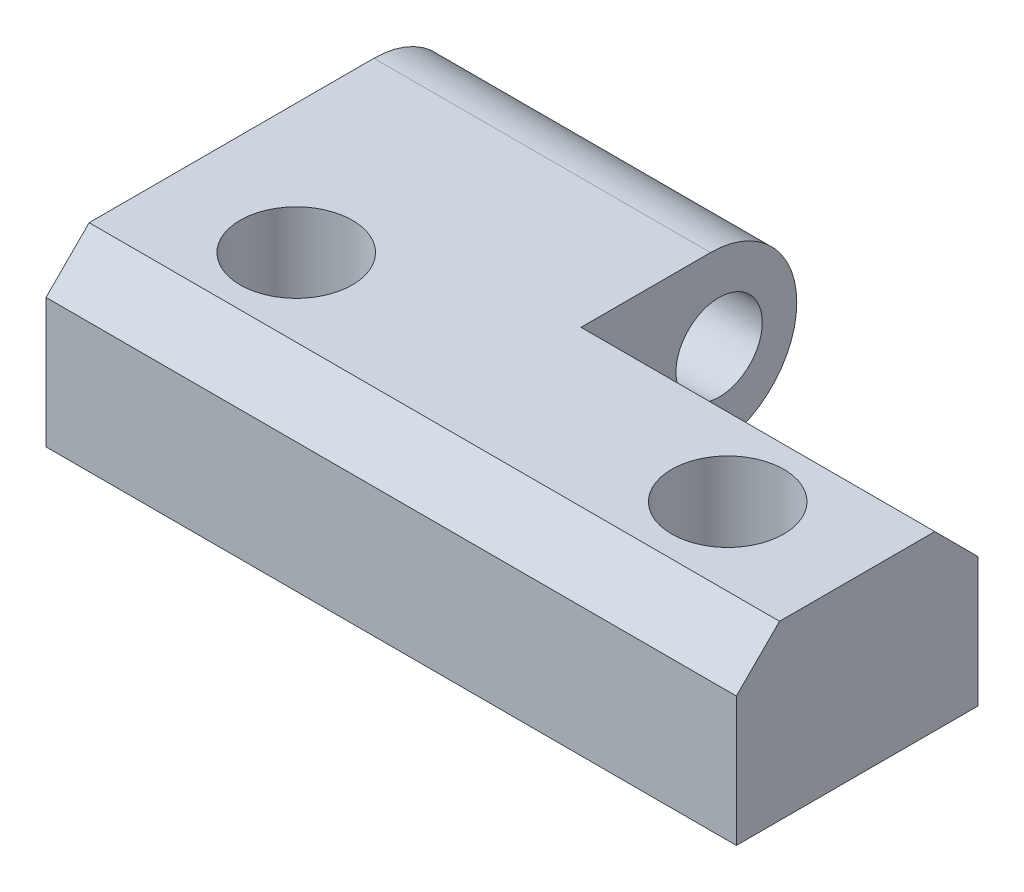
from build123d import *

# Parameters (mm, degrees)
SKIZZE1_R                       = 6.5
AUFSATZ_LINEAR_AUSTRAGEN1_DEPTH = 10
F_10_0MM_STIFTLOCH1_D           = 10
F_10_0MM_STIFTLOCH1_DEPTH       = 22
F_10_0MM_STIFTLOCH1_TIP         = 3.004303095
SCHNITT_LINEAR_AUSTRAGEN2_DEPTH = 49.548944376
FASE1_SIZE                      = 5


with BuildPart() as part:
    # Skizze1 → Aufsatz-Linear austragen1 (new, symmetric)
    with BuildSketch(Plane(origin=(0, 0, 0), x_dir=(1, 0, 0), z_dir=(0, 1, 0))):
        Polygon((-40, -24), (40, -24), (40, 4), (-1, 4), (-1, 24), (-40, 24), align=None)
        with Locations(Location((-25, -10, 0), (0, 0, 270))):
            Circle(SKIZZE1_R, mode=Mode.SUBTRACT)
        with Locations(Location((25, -10, 0), (0, 0, 270))):
            Circle(SKIZZE1_R, mode=Mode.SUBTRACT)
    extrude(amount=AUFSATZ_LINEAR_AUSTRAGEN1_DEPTH, both=True)

    # Ø10.0mm Stiftloch1
    with Locations(Plane(origin=(-1, 0, 0), x_dir=(0, 0, -1), z_dir=(1, 0, 0))):
        with Locations((15, 0)):
            Hole(F_10_0MM_STIFTLOCH1_D / 2, depth=F_10_0MM_STIFTLOCH1_DEPTH)
            with Locations((0, 0, -(F_10_0MM_STIFTLOCH1_DEPTH + F_10_0MM_STIFTLOCH1_TIP / 2))):  # 118° drill point
                Cone(0, F_10_0MM_STIFTLOCH1_D / 2, F_10_0MM_STIFTLOCH1_TIP, mode=Mode.SUBTRACT)

    # Skizze5 → Schnitt-Linear austragen2 (cut, through all)
    with BuildSketch(Plane(origin=(-1, 0, 0), x_dir=(0, 0, -1), z_dir=(1, 0, 0))):
        with BuildLine():
            Line((14, 10), (26, 10))
            Line((26, 10), (26, -10))
            Line((26, -10), (14, -10))
            ThreePointArc((14, -10), (24, 0), (14, 10))
        make_face()
    extrude(amount=-SCHNITT_LINEAR_AUSTRAGEN2_DEPTH, mode=Mode.SUBTRACT)

    # Fase1
    fase1_edges = [part.edges().sort_by_distance(p)[0] for p in [
        (19.5, 10, -4),
        (0, 10, 24),
    ]]
    chamfer(fase1_edges, length=FASE1_SIZE)


solid = part.part
